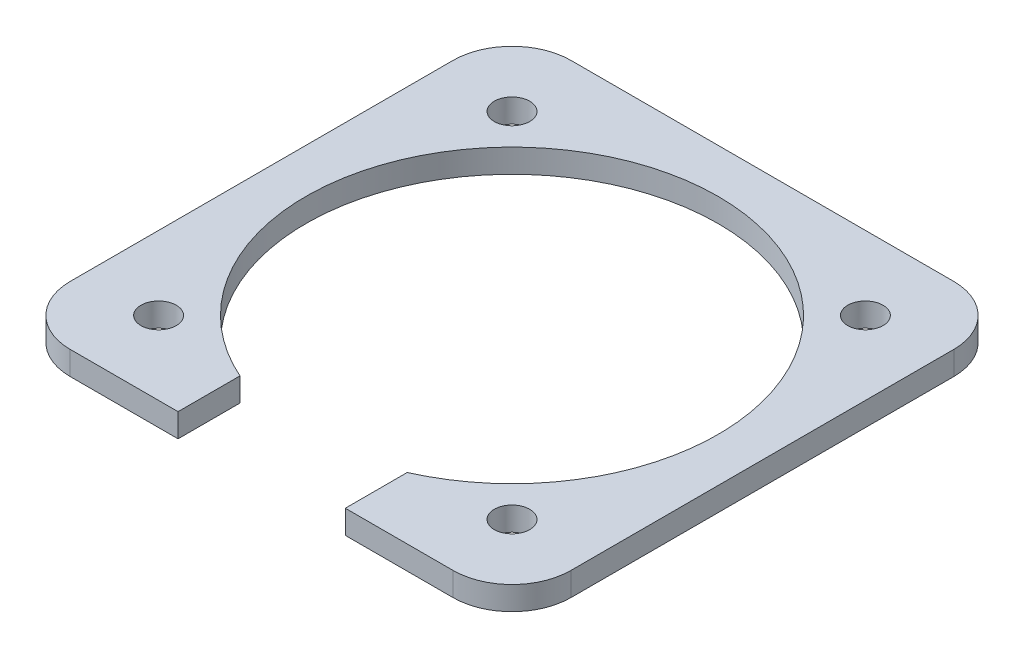
from build123d import *

# Parameters (mm, degrees)
SKETCH1_W           = 40.5
SKETCH1_H           = 40.5
SKETCH1_R           = 17.5
BOSS_EXTRUDE1_DEPTH = 2
SKETCH2_R           = 1.25
CUT_EXTRUDE1_DEPTH  = 2
CUT_EXTRUDE2_DEPTH  = 2
SKETCH4_W           = 42.5
SKETCH4_H           = 42.5
SKETCH4_W_2         = 40.5
SKETCH4_H_2         = 40.5
BOSS_EXTRUDE2_DEPTH = 2
SKETCH5_W           = 14.2
SKETCH5_H           = 2
CUT_EXTRUDE3_DEPTH  = 2
SKETCH6_R           = 1.5
CUT_EXTRUDE4_DEPTH  = 3.5
SKETCH7_R           = 1.5
BOSS_EXTRUDE3_DEPTH = 2
SKETCH8_R           = 1.5
CUT_EXTRUDE5_DEPTH  = 2
FILLET2_R           = 5


with BuildPart() as part:
    # Sketch1 → Boss-Extrude1 (new body)
    with BuildSketch(Plane(origin=(0, 0, 0), x_dir=(1, 0, 0), z_dir=(0, 1, 0))):
        Rectangle(SKETCH1_W, SKETCH1_H)
        with Locations(Location((0, 0, 0), (0, 0, 270))):
            Circle(SKETCH1_R, mode=Mode.SUBTRACT)
    extrude(amount=BOSS_EXTRUDE1_DEPTH)

    # Sketch2 → Cut-Extrude1 (cut)
    with BuildSketch(Plane(origin=(0, 2, 0), x_dir=(1, 0, 0), z_dir=(0, 1, 0))):
        with Locations(Location((-15, 15, 0), (0, 0, 270))):
            Circle(SKETCH2_R)
        with Locations(Location((15, 15, 0), (0, 0, 270))):
            Circle(SKETCH2_R)
        with Locations(Location((-15, -15, 0), (0, 0, 270))):
            Circle(SKETCH2_R)
        with Locations(Location((15, -16.25, 0), (0, 0, 270))):
            Circle(SKETCH2_R)
    extrude(amount=-CUT_EXTRUDE1_DEPTH, mode=Mode.SUBTRACT)

    # Sketch3 → Cut-Extrude2 (cut)
    with BuildSketch(Plane(origin=(0, 2, 0), x_dir=(1, 0, 0), z_dir=(0, 1, 0))):
        Polygon((0, -20.25), (7.1, -20.25), (7.1, -15.994999219), (-7.1, -15.994999219), (-7.1, -20.25), align=None)
    extrude(amount=-CUT_EXTRUDE2_DEPTH, mode=Mode.SUBTRACT)

    # Sketch4 → Boss-Extrude2 (add)
    with BuildSketch(Plane(origin=(0, 2, 0), x_dir=(1, 0, 0), z_dir=(0, 1, 0))):
        Rectangle(SKETCH4_W, SKETCH4_H)
        Rectangle(SKETCH4_W_2, SKETCH4_H_2, mode=Mode.SUBTRACT)
    extrude(amount=-BOSS_EXTRUDE2_DEPTH)

    # Sketch5 → Cut-Extrude3 (cut)
    with BuildSketch(Plane(origin=(0, 2, 0), x_dir=(1, 0, 0), z_dir=(0, 1, 0))):
        with Locations((0, -21.25)):
            Rectangle(SKETCH5_W, SKETCH5_H)
    extrude(amount=-CUT_EXTRUDE3_DEPTH, mode=Mode.SUBTRACT)

    # Sketch6 → Cut-Extrude4 (cut)
    with BuildSketch(Plane(origin=(0, 2, 0), x_dir=(1, 0, 0), z_dir=(0, 1, 0))):
        with Locations(Location((-15, 15, 0), (0, 0, 270))):
            Circle(SKETCH6_R)
        with Locations(Location((15, 15, 0), (0, 0, 270))):
            Circle(SKETCH6_R)
        with Locations(Location((15, -16.25, 0), (0, 0, 270))):
            Circle(SKETCH6_R)
        with Locations(Location((-15, -15, 0), (0, 0, 270))):
            Circle(SKETCH6_R)
    extrude(amount=-CUT_EXTRUDE4_DEPTH, mode=Mode.SUBTRACT)

    # Sketch7 → Boss-Extrude3 (add)
    with BuildSketch(Plane(origin=(0, 2, 0), x_dir=(1, 0, 0), z_dir=(0, 1, 0))):
        with Locations((15, -16.25)):
            Circle(SKETCH7_R)
    extrude(amount=-BOSS_EXTRUDE3_DEPTH)

    # Sketch8 → Cut-Extrude5 (cut)
    with BuildSketch(Plane(origin=(0, 2, 0), x_dir=(1, 0, 0), z_dir=(0, 1, 0))):
        with Locations(Location((15, -15, 0), (0, 0, 270))):
            Circle(SKETCH8_R)
    extrude(amount=-CUT_EXTRUDE5_DEPTH, mode=Mode.SUBTRACT)

    # Fillet2
    fillet2_edges = [part.edges().sort_by_distance(p)[0] for p in [
        (-21.25, 1, 21.25),
        (-21.25, 1, -21.25),
        (21.25, 1, -21.25),
        (21.25, 1, 21.25),
    ]]
    fillet(fillet2_edges, radius=FILLET2_R)


solid = part.part
